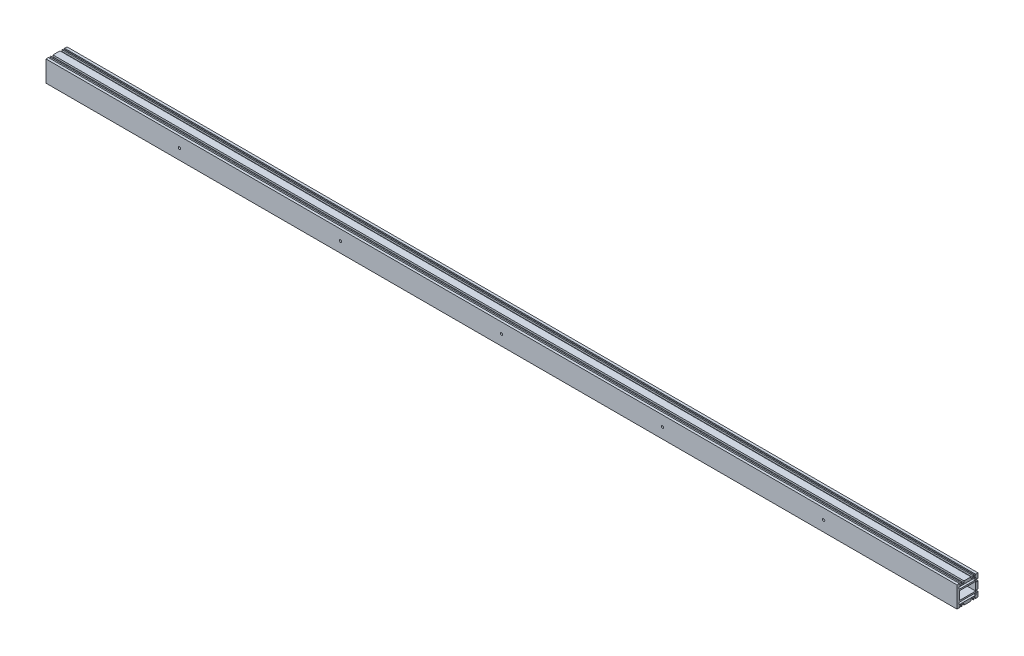
from build123d import *

# Parameters (mm, degrees)
SKETCH_1_W             = 23.5
SKETCH_1_H             = 12
EXTRUDE_1_DEPTH        = 650.5
HOLE_WIZARD_M6_1_D     = 5
HOLE_WIZARD_M6_1_DEPTH = 19
HOLE_WIZARD_M6_1_TIP   = 1.502151548
HOLE_WIZARD_M4_1_D     = 3.3
HOLE_WIZARD_M4_1_DEPTH = 15.5
HOLE_WIZARD_M4_1_TIP   = 0.991420021
HOLE_WIZARD_M6_2_D     = 5
HOLE_WIZARD_M6_2_DEPTH = 17
HOLE_WIZARD_M6_2_TIP   = 1.502151548
HOLE_WIZARD_M4_2_D     = 3.3
HOLE_WIZARD_M4_2_DEPTH = 11.5
HOLE_WIZARD_M4_2_TIP   = 0.991420021


with BuildPart() as part:
    # 草图1 → 凸台-拉伸1 (new, symmetric)
    with BuildSketch(Plane(origin=(0, 0, 0), x_dir=(0, 0, -1), z_dir=(1, 0, 0))):
        Polygon((-15, 15), (-11.5, 15), (-11.5, 13.5), (-11, 13.5), (-11, 12), (-9.5, 12), (-9.5, 15), (-8, 15), (-8, 12.5), (-5, 12.5), (-5, 15), (5, 15), (5, 12.5), (8, 12.5), (8, 15), (9.5, 15), (9.5, 12), (11, 12), (11, 13.5), (11.5, 13.5), (11.5, 15), (15, 15), (15, 8), (12.5, 8), (12.5, 5), (15, 5), (15, -5), (12.5, -5), (12.5, -8), (15, -8), (15, -15), (11.5, -15), (11.5, -13.5), (11, -13.5), (11, -12), (9.5, -12), (9.5, -15), (8, -15), (8, -12.5), (5, -12.5), (5, -15), (-5, -15), (-5, -12.5), (-8, -12.5), (-8, -15), (-9.5, -15), (-9.5, -12), (-11, -12), (-11, -13.5), (-11.5, -13.5), (-11.5, -15), (-15, -15), align=None)
        with BuildLine():
            Line((12, -10.5), (12, -8.5))
            ThreePointArc((12, -8.5), (11.853553391, -8.146446609), (11.5, -8))
            Line((11.5, -8), (-11.5, -8))
            ThreePointArc((-11.5, -8), (-11.853553391, -8.146446609), (-12, -8.5))
            Line((-12, -8.5), (-12, -10.5))
            ThreePointArc((-12, -10.5), (-11.853553391, -10.853553391), (-11.5, -11))
            Line((-11.5, -11), (11.5, -11))
            ThreePointArc((11.5, -11), (11.853553391, -10.853553391), (12, -10.5))
        make_face(mode=Mode.SUBTRACT)
        with BuildLine():
            Line((-11.5, 11), (11.5, 11))
            ThreePointArc((11.5, 11), (11.853553391, 10.853553391), (12, 10.5))
            Line((12, 10.5), (12, 8.5))
            ThreePointArc((12, 8.5), (11.853553391, 8.146446609), (11.5, 8))
            Line((11.5, 8), (-11.5, 8))
            ThreePointArc((-11.5, 8), (-11.853553391, 8.146446609), (-12, 8.5))
            Line((-12, 8.5), (-12, 10.5))
            ThreePointArc((-12, 10.5), (-11.853553391, 10.853553391), (-11.5, 11))
        make_face(mode=Mode.SUBTRACT)
        Rectangle(SKETCH_1_W, SKETCH_1_H, mode=Mode.SUBTRACT)
    extrude(amount=EXTRUDE_1_DEPTH, both=True)

    # M6 螺纹孔1
    with Locations(Plane(origin=(0, 0, -15), x_dir=(-1, 0, 0), z_dir=(0, 0, -1))):
        with Locations((-630.5, 0), (-615.5, 0), (342.5, 0), (327.5, 0), (427.5, 0), (412.5, 0), (630.5, 0), (615.5, 0)):
            Hole(HOLE_WIZARD_M6_1_D / 2, depth=HOLE_WIZARD_M6_1_DEPTH)
            with Locations((0, 0, -(HOLE_WIZARD_M6_1_DEPTH + HOLE_WIZARD_M6_1_TIP / 2))):  # 118° drill point
                Cone(0, HOLE_WIZARD_M6_1_D / 2, HOLE_WIZARD_M6_1_TIP, mode=Mode.SUBTRACT)

    # M4 螺纹孔1
    with Locations(Plane.XY.offset(15)):
        with Locations((-460, 0), (-230, 0), (0, 0), (230, 0), (460, 0)):
            Hole(HOLE_WIZARD_M4_1_D / 2, depth=HOLE_WIZARD_M4_1_DEPTH)
            with Locations((0, 0, -(HOLE_WIZARD_M4_1_DEPTH + HOLE_WIZARD_M4_1_TIP / 2))):  # 118° drill point
                Cone(0, HOLE_WIZARD_M4_1_D / 2, HOLE_WIZARD_M4_1_TIP, mode=Mode.SUBTRACT)

    # M6 螺纹孔2
    with Locations(Plane(origin=(0, -15, 0), x_dir=(-1, 0, 0), z_dir=(0, -1, 0))):
        with Locations((310.5, 0), (285.5, 0), (-285.5, 0), (-310.5, 0), (590.5, 0), (470.5, 0)):
            Hole(HOLE_WIZARD_M6_2_D / 2, depth=HOLE_WIZARD_M6_2_DEPTH)
            with Locations((0, 0, -(HOLE_WIZARD_M6_2_DEPTH + HOLE_WIZARD_M6_2_TIP / 2))):  # 118° drill point
                Cone(0, HOLE_WIZARD_M6_2_D / 2, HOLE_WIZARD_M6_2_TIP, mode=Mode.SUBTRACT)

    # M4 螺纹孔2
    with Locations(Plane(origin=(0, -15, 0), x_dir=(-1, 0, 0), z_dir=(0, -1, 0))):
        with Locations((642.5, 0), (615.5, 0)):
            Hole(HOLE_WIZARD_M4_2_D / 2, depth=HOLE_WIZARD_M4_2_DEPTH)
            with Locations((0, 0, -(HOLE_WIZARD_M4_2_DEPTH + HOLE_WIZARD_M4_2_TIP / 2))):  # 118° drill point
                Cone(0, HOLE_WIZARD_M4_2_D / 2, HOLE_WIZARD_M4_2_TIP, mode=Mode.SUBTRACT)


solid = part.part
